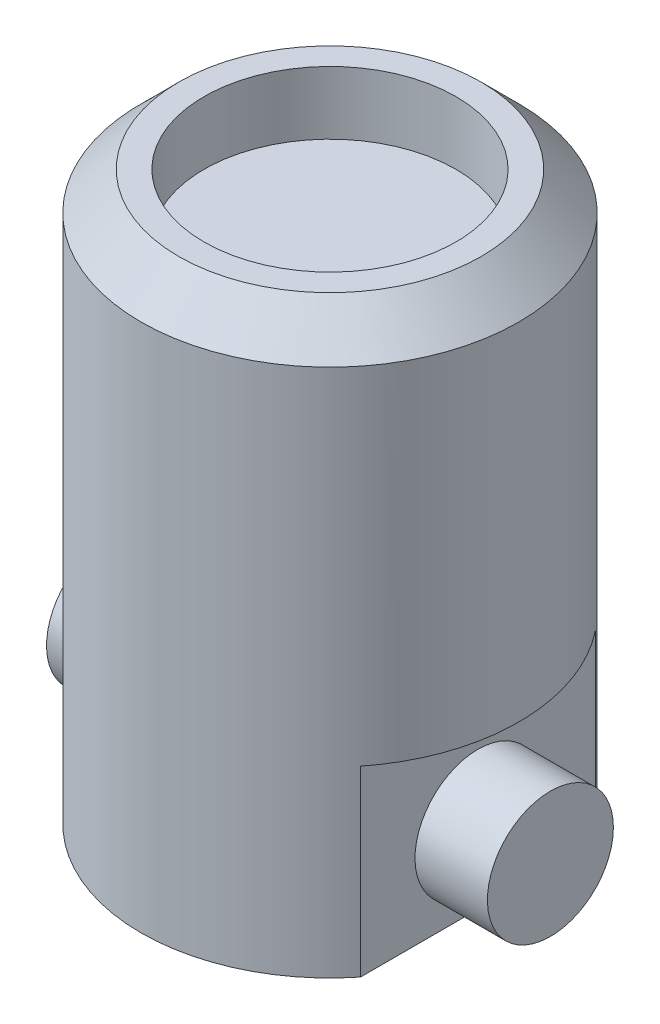
from build123d import *

# Parameters (mm, degrees)
SKETCH1_R           = 30
BOSS_EXTRUDE1_DEPTH = 90
CUT_EXTRUDE3_DEPTH  = 100.498743711
SKETCH4_R           = 10
BOSS_EXTRUDE2_DEPTH = 35
SKETCH5_R           = 20
CUT_EXTRUDE4_DEPTH  = 10
CHAMFER1_SIZE       = 6


with BuildPart() as part:
    # Sketch1 → Boss-Extrude1 (new body)
    with BuildSketch(Plane(origin=(0, 0, 0), x_dir=(1, 0, 0), z_dir=(0, 1, 0))):
        with Locations(Location((0, 0, 0), (0, 0, 90))):
            Circle(SKETCH1_R)
    extrude(amount=BOSS_EXTRUDE1_DEPTH)

    # Sketch2 → Cut-Extrude3 (cut, symmetric)
    with BuildSketch(Plane.XY):
        Polygon((-249.40152817, 29), (-30, 29), (-23.5, 29), (-23.5, 0), (-23.5, -219.40152817), (-348.134648092, -514.631044837), (-574.036176263, -266.229516667), align=None)
    cut_extrude3 = extrude(amount=CUT_EXTRUDE3_DEPTH, both=True, mode=Mode.SUBTRACT)

    # Mirror1: Cut-Extrude3 across plane
    add(cut_extrude3.mirror(Plane(origin=(0, 0, 0), x_dir=(0, 0, 1), z_dir=(1, 0, 0))), mode=Mode.SUBTRACT)

    # Sketch4 → Boss-Extrude2 (add, symmetric)
    with BuildSketch(Plane(origin=(0, 0, 0), x_dir=(0, 0, -1), z_dir=(1, 0, 0))):
        with Locations(Location((0, 12, 0), (0, 0, 90))):
            Circle(SKETCH4_R)
    extrude(amount=BOSS_EXTRUDE2_DEPTH, both=True)

    # Sketch5 → Cut-Extrude4 (cut)
    with BuildSketch(Plane(origin=(0, 90, 0), x_dir=(1, 0, 0), z_dir=(0, 1, 0))):
        with Locations(Location((0, 0, 0), (0, 0, 270))):
            Circle(SKETCH5_R)
    extrude(amount=-CUT_EXTRUDE4_DEPTH, mode=Mode.SUBTRACT)

    # Chamfer1
    chamfer1_edges = [part.edges().sort_by_distance(p)[0] for p in [
        (0, 90, 30),
    ]]
    chamfer(chamfer1_edges, length=CHAMFER1_SIZE)


solid = part.part
